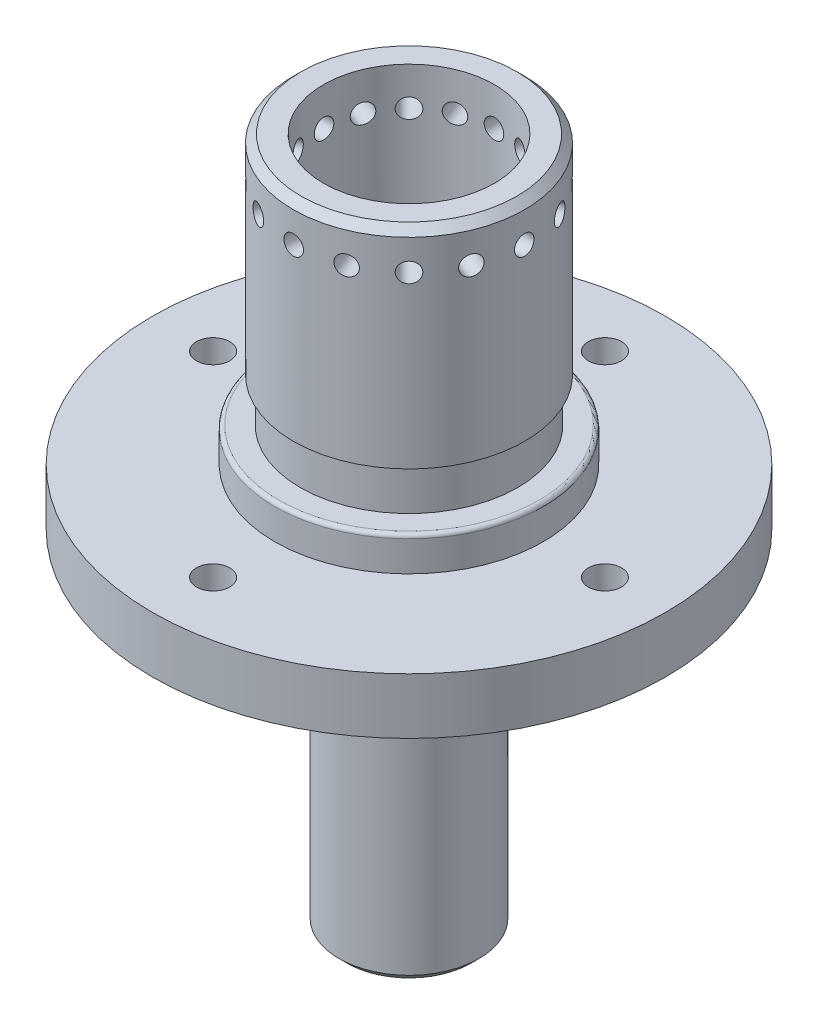
from build123d import *

# Parameters (mm, degrees)
DRIVE_PIN_HOLES_D             = 6.8
DRIVE_PIN_HOLES_PATTERN_COUNT = 4
F_10_0MM_DOWEL_HOLE1_D        = 10
HUB_FILLET_R                  = 0.79375
SKETCH14_R                    = 2
PIN_HOLES_DEPTH               = 103.215889052
PIN_HOLE_PATTERN_COUNT        = 16


with BuildPart() as part:
    # Sketch1 → Bearing Shaft/Flange Support (revolve)
    with BuildSketch(Plane(origin=(0, 0, 0), x_dir=(0, 0, -1), z_dir=(1, 0, 0))):
        Polygon((0, 0), (-27.254672075, 0), (-25.0825, -12.319), (-25.0825, -17.0815), (-14.2875, -17.0815), (-14.2875, -68.834), (-12.7, -70.4215), (0, -70.4215), align=None)
    revolve(axis=Axis((0, 0, 0), (0, 1, 0)))

    # Sketch2 → Drive Pin Support (revolve)
    with BuildSketch(Plane(origin=(0, 0, 0), x_dir=(0, 0, -1), z_dir=(1, 0, 0))):
        Polygon((0, 0), (-52.3875, 0), (-52.3875, 11.43), (-27.4096, 11.43), (-27.4096, 18.43), (-22.225, 18.43), (-22.225, 27.305), (-23.61946, 27.305), (-23.61946, 68.2625), (-22.03196, 69.85), (0, 69.85), align=None)
    revolve(axis=Axis((0, 0, 0), (0, 1, 0)))

    # Sketch5 → Center Mass Removal (revolve, cut)
    with BuildSketch(Plane(origin=(0, 0, 0), x_dir=(0, 0, -1), z_dir=(1, 0, 0))):
        Polygon((0, 69.85), (17.4625, 69.85), (17.4625, 22.225), (12.7, -9.525), (0, -9.525), align=None)
    revolve(axis=Axis((0, 0, 0), (0, -1, 0)), mode=Mode.SUBTRACT)

    # Drive Pin Holes (through all)
    with Locations(Plane(origin=(0, 0, 0), x_dir=(-1, 0, 0), z_dir=(0, -1, 0))):
        with Locations((0, -40)):
            drive_pin_holes = Hole(DRIVE_PIN_HOLES_D / 2)

    # Drive Pin Holes Pattern: Drive Pin Holes ×4 about axis
    drive_pin_holes_pattern_axis = Axis((0, 0, 0), (0, -1, 0))
    for i in range(1, DRIVE_PIN_HOLES_PATTERN_COUNT):
        add(drive_pin_holes.rotate(drive_pin_holes_pattern_axis, i * 360 / DRIVE_PIN_HOLES_PATTERN_COUNT), mode=Mode.SUBTRACT)

    # Ø10.0mm Dowel Hole1 (through all)
    with Locations(Plane(origin=(0, -70.4215, 0), x_dir=(-1, 0, 0), z_dir=(0, -1, 0))):
        with Locations((0, 0)):
            Hole(F_10_0MM_DOWEL_HOLE1_D / 2)

    # Hub Fillet
    hub_fillet_edges = [part.edges().sort_by_distance(p)[0] for p in [
        (0, 18.43, -27.4096),
    ]]
    fillet(hub_fillet_edges, radius=HUB_FILLET_R)

    # Sketch14 → Pin Holes (cut, through all)
    with BuildSketch(Plane(origin=(0, 0, 0), x_dir=(0, 0, -1), z_dir=(1, 0, 0))):
        with Locations((0, 62.049406)):
            Circle(SKETCH14_R)
    pin_holes = extrude(amount=-PIN_HOLES_DEPTH, mode=Mode.SUBTRACT)

    # Pin Hole Pattern: Pin Holes ×16 about axis
    pin_hole_pattern_axis = Axis((0, 69.85, 0), (0, 1, 0))
    for i in range(1, PIN_HOLE_PATTERN_COUNT):
        add(pin_holes.rotate(pin_hole_pattern_axis, i * 360 / PIN_HOLE_PATTERN_COUNT), mode=Mode.SUBTRACT)


solid = part.part
